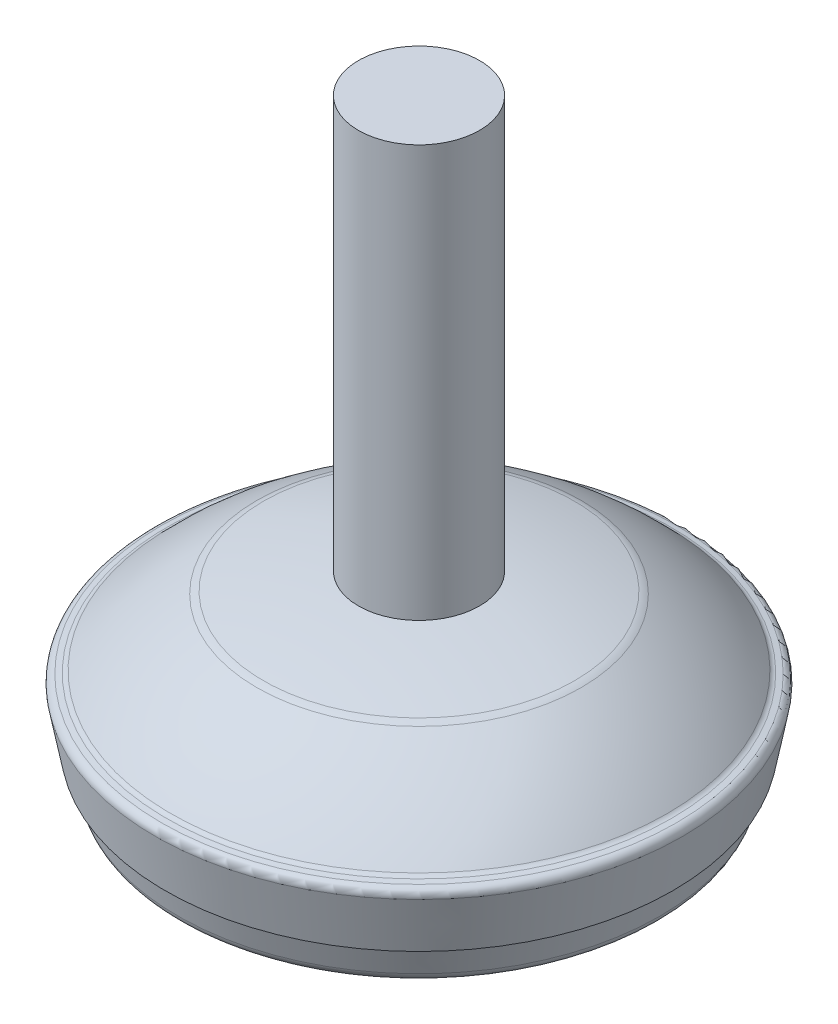
from build123d import *

# Parameters (mm, degrees)
FILLET1_R                       = 0.5
FILLET2_R                       = 2
SKETCH2_R                       = 4
BOSS_EXTRUDE1_DEPTH             = 27
BOSS_EXTRUDE1_DIRECTION_2_REACH = 28.627
BOSS_EXTRUDE2_REACH             = 48.651
SKETCH3_R                       = 16.4
SKETCH4_W                       = 1.75
SKETCH4_H                       = 1
SKETCH4_W_2                     = 1.25
FILLET3_R                       = 0.85


with BuildPart() as part:
    # Sketch1 → Revolve1 (revolve)
    with BuildSketch(Plane.XY):
        with BuildLine():
            Line((16.5, -6), (17.5, -6.190885429))
            Line((17.5, -6.190885429), (16.75, -10.11994384))
            Line((16.75, -10.11994384), (16.648194438, -10.11994384))
            Line((16.648194438, -10.11994384), (16.65177354, -10.10119384))
            Line((16.65177354, -10.10119384), (17.38302354, -6.270361889))
            Line((17.38302354, -6.270361889), (16.448994883, -6.092069428))
            ThreePointArc((16.448994883, -6.092069428), (13.65084506, -3.540480711), (10.463109741, -1.496320506))
            ThreePointArc((10.463109741, -1.496320506), (5.277934644, -0.450620664), (0, -0.1))
            Line((0, -0.1), (0, 0))
            ThreePointArc((0, 0), (5.296641017, -0.352230908), (10.5, -1.402720303))
            ThreePointArc((10.5, -1.402720303), (13.694296081, -3.447780521), (16.5, -6))
        make_face()
    revolve(axis=Axis((0, -0.1, 0), (0, 1, 0)))

    # Fillet1
    fillet1_edges = [part.edges().sort_by_distance(p)[0] for p in [
        (-17.38302354, -6.270361889, 0),
        (-16.5, -6, 0),
        (-17.5, -6.190885429, 0),
    ]]
    fillet(fillet1_edges, radius=FILLET1_R)

    # Fillet2
    fillet2_edges = [part.edges().sort_by_distance(p)[0] for p in [
        (-10.463109741, -1.496320506, 0),
        (-10.5, -1.402720303, 0),
    ]]
    fillet(fillet2_edges, radius=FILLET2_R)

    # Sketch2 → Boss-Extrude1 (add)
    with BuildSketch(Plane(origin=(0, 0, 0), x_dir=(1, 0, 0), z_dir=(0, 1, 0))):
        Circle(SKETCH2_R)
    extrude(amount=BOSS_EXTRUDE1_DEPTH)

    # Sketch2 → Boss-Extrude1 direction 2 (add, up to next)
    with BuildSketch(Plane(origin=(0, 0, 0), x_dir=(1, 0, 0), z_dir=(0, 1, 0)), mode=Mode.PRIVATE) as boss_extrude1_direction_2_sk1:
        Circle(SKETCH2_R)
    boss_extrude1_direction_2_tool1 = extrude(boss_extrude1_direction_2_sk1.sketch, amount=-BOSS_EXTRUDE1_DIRECTION_2_REACH, mode=Mode.PRIVATE) - part.part
    add(boss_extrude1_direction_2_tool1.solids().sort_by_distance((0, 0, 0))[0])


with BuildPart() as body_2:

    # Sketch3 → Boss-Extrude2 (new, up to next)
    with BuildSketch(Plane(origin=(0, -12.61994384, 0), x_dir=(-1, 0, 0), z_dir=(0, -1, 0)), mode=Mode.PRIVATE) as boss_extrude2_sk1:
        Circle(SKETCH3_R)
    boss_extrude2_tool1 = extrude(boss_extrude2_sk1.sketch, amount=-BOSS_EXTRUDE2_REACH, mode=Mode.PRIVATE) - part.part
    add(boss_extrude2_tool1.solids().sort_by_distance((0, -12.619944, 0))[0])

    # Sketch4 → Cut-Revolve2 (revolve, cut)
    with BuildSketch(Plane.XY):
        Polygon((-16.4, -10.11994384), (-15.75, -12.61994384), (-16.4, -12.61994384), align=None)
        with Locations((-12.125, -12.11994384)):
            Rectangle(SKETCH4_W, SKETCH4_H)
        with Locations((-8.875, -12.11994384)):
            Rectangle(SKETCH4_W_2, SKETCH4_H)
    revolve(axis=Axis((0, -12.61994384, 0), (0, 1, 0)), mode=Mode.SUBTRACT)

    # Fillet3
    fillet3_edges = [body_2.edges().sort_by_distance(p)[0] for p in [
        (8.25, -12.61994384, 0),
        (13, -12.61994384, 0),
        (15.75, -12.61994384, 0),
        (11.25, -12.61994384, 0),
        (9.5, -12.61994384, 0),
    ]]
    fillet(fillet3_edges, radius=FILLET3_R)


solid = Compound([part.part, body_2.part])
